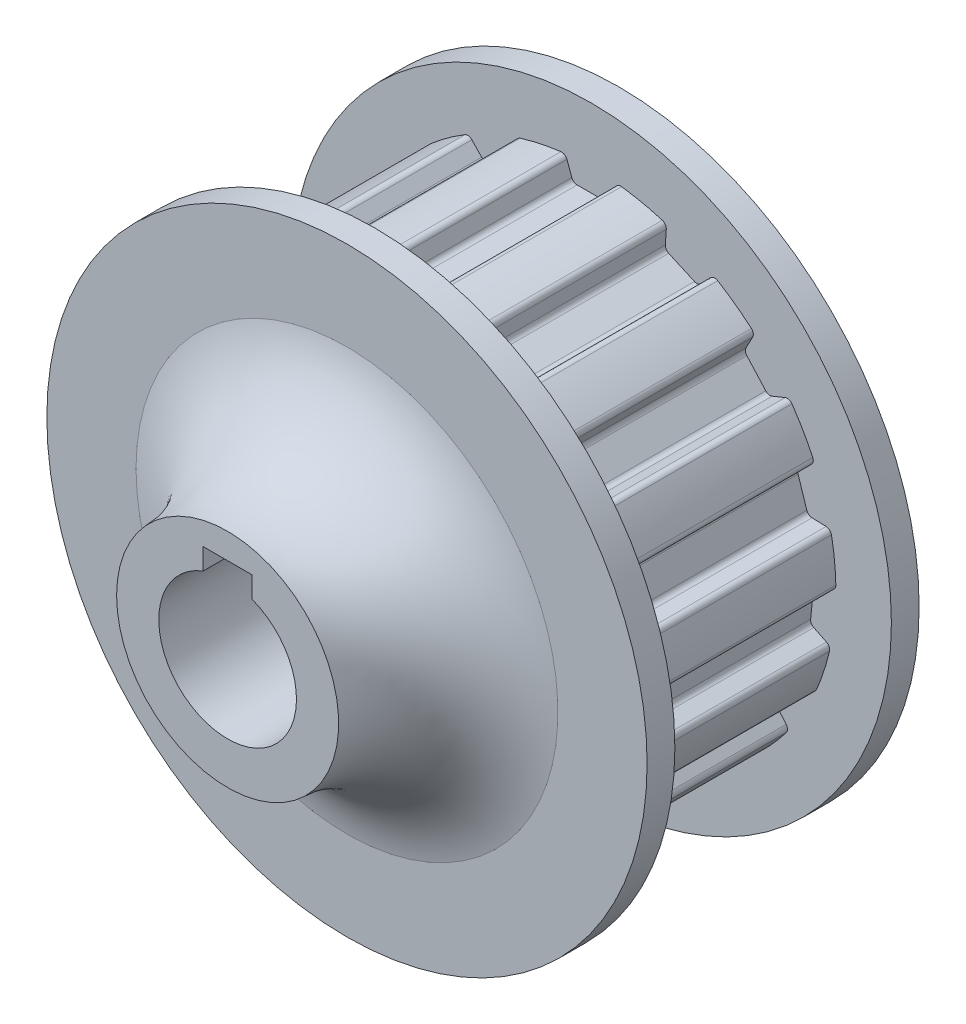
from build123d import *

# Parameters (mm, degrees)
BOSS_EXTRUDE1_DEPTH      = 7.25
BOSS_EXTRUDE1_DEPTH_BACK = 7.25
SKETCH7_R                = 22.031647778
CUT_EXTRUDE3_DEPTH       = 36.98314894
CUT_EXTRUDE3_DEPTH_BACK  = 36.98314894
SKETCH15_R               = 8.008120878
SKETCH15_R_2             = 2.25
BOSS_EXTRUDE2_DEPTH      = 5.5
SKETCH16_R               = 5
CUT_EXTRUDE4_DEPTH       = 3
BOSS_EXTRUDE3_START      = 7.5
SKETCH17_R               = 22.031647778
SKETCH17_R_2             = 5
BOSS_EXTRUDE3_DEPTH      = 7.5
CUT_EXTRUDE2_DEPTH       = 36.98314894
CUT_EXTRUDE2_DEPTH_BACK  = 36.98314894
FILLET2_R                = 0.51
BOSS_EXTRUDE4_START      = 2.5
SKETCH18_R               = 27.031647778
SKETCH18_R_2             = 22.031647778
SKETCH18_R_3             = 5
BOSS_EXTRUDE4_DEPTH      = 2.5
BOSS_EXTRUDE5_START      = -2.5
SKETCH19_R               = 27.031647778
SKETCH19_R_2             = 19
BOSS_EXTRUDE5_DEPTH      = 2.5
CUT_EXTRUDE5_DEPTH       = 52.999831377
SKETCH21_R               = 8.008120878
SKETCH21_R_2             = 6.2
SKETCH21_R_3             = 2.25
BOSS_EXTRUDE6_DEPTH      = 2.5
SKETCH21_4_R             = 8.008120878
SKETCH21_4_R_2           = 6.2
BOSS_EXTRUDE7_DEPTH      = 12


with BuildPart() as part:
    # Sketch7 → Boss-Extrude1 (new, two sides: drawn at the far end of the back side and taken through both)
    with BuildSketch(Plane.XY.offset(-BOSS_EXTRUDE1_DEPTH_BACK)):
        Circle(SKETCH7_R)
    extrude(amount=BOSS_EXTRUDE1_DEPTH + BOSS_EXTRUDE1_DEPTH_BACK)

    # Sketch14 → Revolve1 (revolve)
    with BuildSketch(Plane(origin=(0, 0, 0), x_dir=(0, 0, -1), z_dir=(1, 0, 0)), mode=Mode.PRIVATE) as revolve1_sk:
        Polygon((-18, 6.739517467), (-18, 0), (0, 0), (0, 19), (-3.355534752, 19), (-11.020158508, 12.583105693), align=None)
        with BuildLine():
            ThreePointArc((-7.25, 19), (-8.580081567, 15.465471544), (-11.020158508, 12.583105693))
            Line((-11.020158508, 12.583105693), (-3.355534752, 19))
            Line((-3.355534752, 19), (-7.25, 19))
        make_face()
        with BuildLine():
            Line((-18, 10), (-18, 6.739517467))
            Line((-18, 6.739517467), (-11.020158508, 12.583105693))
            ThreePointArc((-11.020158508, 12.583105693), (-14.286666254, 10.687865845), (-18, 10))
        make_face()
    revolve(revolve1_sk.sketch.rotate(Axis((0, 0, -36.129595921), (0, 0, 1)), 270), axis=Axis((0, 0, -36.129595921), (0, 0, 1)))

    # Sketch10 → Cut-Extrude3 (cut, two sides: drawn at the far end of the back side and taken through both)
    with BuildSketch(Plane.XY.offset(-CUT_EXTRUDE3_DEPTH_BACK)):
        with BuildLine():
            Line((2.2, 7.7), (-2.2, 7.7))
            Line((-2.2, 7.7), (-2.2, 5.796550698))
            ThreePointArc((-2.2, 5.796550698), (0, 6.2), (2.2, 5.796550698))
            Line((2.2, 5.796550698), (2.2, 7.7))
        make_face()
        with BuildLine():
            ThreePointArc((2.2, 5.796550698), (0, 6.2), (-2.2, 5.796550698))
            Line((-2.2, 5.796550698), (-2.2, 0))
            Line((-2.2, 0), (2.2, 0))
            Line((2.2, 0), (2.2, 5.796550698))
        make_face()
        with BuildLine():
            Line((-2.2, 0), (-2.2, 5.796550698))
            ThreePointArc((-2.2, 5.796550698), (-3.521363372, -5.102940329), (6.2, 0))
            ThreePointArc((6.2, 0), (5.102940329, 3.521363372), (2.2, 5.796550698))
            Line((2.2, 5.796550698), (2.2, 0))
            Line((2.2, 0), (-2.2, 0))
        make_face()
        with BuildLine():
            ThreePointArc((2.2, 5.796550698), (0, 6.2), (-2.2, 5.796550698))
            Line((-2.2, 5.796550698), (-2.2, 0))
            Line((-2.2, 0), (2.2, 0))
            Line((2.2, 0), (2.2, 5.796550698))
        make_face()
        with BuildLine():
            Line((-2.2, 0), (-2.2, 5.796550698))
            ThreePointArc((-2.2, 5.796550698), (-3.521363372, -5.102940329), (6.2, 0))
            ThreePointArc((6.2, 0), (5.102940329, 3.521363372), (2.2, 5.796550698))
            Line((2.2, 5.796550698), (2.2, 0))
            Line((2.2, 0), (-2.2, 0))
        make_face()
    extrude(amount=CUT_EXTRUDE3_DEPTH + CUT_EXTRUDE3_DEPTH_BACK, mode=Mode.SUBTRACT)

    # Sketch15 → Boss-Extrude2 (add)
    with BuildSketch(Plane(origin=(0, 0, -7.25), x_dir=(-1, 0, 0), z_dir=(0, 0, -1))):
        Circle(SKETCH15_R)
        Circle(SKETCH15_R_2, mode=Mode.SUBTRACT)
    extrude(amount=-BOSS_EXTRUDE2_DEPTH)

    # Sketch16 → Cut-Extrude4 (cut)
    with BuildSketch(Plane(origin=(0, 0, -7.25), x_dir=(-1, 0, 0), z_dir=(0, 0, -1))):
        Circle(SKETCH16_R)
    extrude(amount=-CUT_EXTRUDE4_DEPTH, mode=Mode.SUBTRACT)

    # Sketch17 → Boss-Extrude3 (add)
    with BuildSketch(Plane(origin=(0, 0, -7.25), x_dir=(-1, 0, 0), z_dir=(0, 0, -1)).offset(BOSS_EXTRUDE3_START)):
        with Locations(Location((0, 0, 0), (0, 0, 180))):
            Circle(SKETCH17_R)
        Circle(SKETCH17_R_2, mode=Mode.SUBTRACT)
    extrude(amount=-BOSS_EXTRUDE3_DEPTH)

    # Sketch8 → Cut-Extrude2 (cut, two sides: drawn at the far end of the back side and taken through both)
    with BuildSketch(Plane.XY.offset(-CUT_EXTRUDE2_DEPTH_BACK)):
        Polygon((-1.629816853, 19.998625671), (-2.369776385, 22.031647778), (2.369776385, 22.031647778), (1.629816853, 19.998625671), align=None)
        Polygon((6.645262089, 18.932559877), (6.796180007, 21.090786644), (11.125976911, 19.16303686), (9.623085654, 17.606747406), align=None)
        Polygon((13.771314846, 14.592882482), (14.787015134, 16.503136895), (17.958394952, 12.980962779), (15.952435523, 12.170502561), align=None)
        Polygon((18.516182157, 7.729963135), (20.221041008, 9.061944851), (21.68564336, 4.554362304), (19.523464367, 4.629867259), align=None)
        Polygon((20.059433359, -0.469537064), (22.15866519, 0.053860216), (21.663247022, -4.659728787), (19.718708857, -3.711314154), align=None)
        Polygon((18.134226299, -8.587850038), (20.264854855, -8.963537338), (17.89507847, -13.06811044), (16.504409446, -11.410775634), align=None)
        Polygon((13.073446767, -15.221245722), (14.867067016, -16.431057856), (11.032688279, -19.216897077), (10.436347704, -17.137210342), align=None)
        Polygon((5.752149521, -19.222749741), (6.898628226, -21.057499199), (2.262646056, -22.042907629), (2.563746633, -19.900465696), align=None)
        Polygon((-2.563746633, -19.900465696), (-2.262646056, -22.042907629), (-6.898628226, -21.057499199), (-5.752149521, -19.222749741), align=None)
        Polygon((-10.436347704, -17.137210342), (-11.032688279, -19.216897077), (-14.867067016, -16.431057856), (-13.073446767, -15.221245722), align=None)
        Polygon((-16.504409446, -11.410775634), (-17.89507847, -13.06811044), (-20.264854855, -8.963537338), (-18.134226299, -8.587850038), align=None)
        Polygon((-19.718708857, -3.711314154), (-21.663247022, -4.659728787), (-22.15866519, 0.053860216), (-20.059433359, -0.469537064), align=None)
        Polygon((-19.523464367, 4.629867259), (-21.68564336, 4.554362304), (-20.221041008, 9.061944851), (-18.516182157, 7.729963135), align=None)
        Polygon((-15.952435523, 12.170502561), (-17.958394952, 12.980962779), (-14.787015134, 16.503136895), (-13.771314846, 14.592882482), align=None)
        Polygon((-9.623085654, 17.606747406), (-11.125976911, 19.16303686), (-6.796180007, 21.090786644), (-6.645262089, 18.932559877), align=None)
    extrude(amount=CUT_EXTRUDE2_DEPTH + CUT_EXTRUDE2_DEPTH_BACK, mode=Mode.SUBTRACT)

    # Fillet2
    fillet2_edges = [part.edges().sort_by_distance(p)[0] for p in [
        (6.787047671, 20.960188161, -3.75),
        (11.035034049, 19.06886277, -3.75),
        (9.623085654, 17.606747406, -3.75),
        (6.645262089, 18.932559877, -3.75),
        (14.725553141, 16.387543699, -3.75),
        (17.837010461, 12.931920261, -3.75),
        (15.952435523, 12.170502561, -3.75),
        (13.771314846, 14.592882482, -3.75),
        (20.117876696, 8.981344056, -3.75),
        (21.55480572, 4.558931255, -3.75),
        (19.523464367, 4.629867259, -3.75),
        (18.516182157, 7.729963135, -3.75),
        (22.031636605, 0.022188433, -3.75),
        (21.545579251, -4.60233838, -3.75),
        (19.718708857, -3.711314154, -3.75),
        (20.059433359, -0.469537064, -3.75),
        (20.135926394, -8.940803772, -3.75),
        (17.810926394, -12.9678219, -3.75),
        (16.504409446, -11.410775634, -3.75),
        (18.134226299, -8.587850038, -3.75),
        (14.75853158, -16.35784978, -3.75),
        (10.996602556, -19.091051203, -3.75),
        (10.436347704, -17.137210342, -3.75),
        (13.073446767, -15.221245722, -3.75),
        (6.829252579, -20.946474955, -3.75),
        (2.280866235, -21.913264317, -3.75),
        (2.563746633, -19.900465696, -3.75),
        (5.752149521, -19.222749741, -3.75),
        (-2.280866235, -21.913264317, -3.75),
        (-6.829252579, -20.946474955, -3.75),
        (-5.752149521, -19.222749741, -3.75),
        (-2.563746633, -19.900465696, -3.75),
        (-10.996602556, -19.091051203, -3.75),
        (-14.75853158, -16.35784978, -3.75),
        (-13.073446767, -15.221245722, -3.75),
        (-10.436347704, -17.137210342, -3.75),
        (-17.810926394, -12.9678219, -3.75),
        (-20.135926394, -8.940803772, -3.75),
        (-18.134226299, -8.587850038, -3.75),
        (-16.504409446, -11.410775634, -3.75),
        (-21.545579251, -4.60233838, -3.75),
        (-22.031636605, 0.022188433, -3.75),
        (-20.059433359, -0.469537064, -3.75),
        (-19.718708857, -3.711314154, -3.75),
        (-21.55480572, 4.558931255, -3.75),
        (-20.117876696, 8.981344056, -3.75),
        (-18.516182157, 7.729963135, -3.75),
        (-19.523464367, 4.629867259, -3.75),
        (-17.837010461, 12.931920261, -3.75),
        (-14.725553141, 16.387543699, -3.75),
        (-13.771314846, 14.592882482, -3.75),
        (-15.952435523, 12.170502561, -3.75),
        (-11.035034049, 19.06886277, -3.75),
        (-6.787047671, 20.960188161, -3.75),
        (-6.645262089, 18.932559877, -3.75),
        (-9.623085654, 17.606747406, -3.75),
        (-2.325, 21.908625671, -3.75),
        (2.325, 21.908625671, -3.75),
        (1.629816853, 19.998625671, -3.75),
        (-1.629816853, 19.998625671, -3.75),
    ]]
    fillet(fillet2_edges, radius=FILLET2_R)

    # Sketch18 → Boss-Extrude4 (add)
    # profile 1 of 2: a face of its own
    with BuildSketch(Plane(origin=(0, 0, -14.75), x_dir=(-1, 0, 0), z_dir=(0, 0, -1)).offset(BOSS_EXTRUDE4_START)):
        Circle(SKETCH18_R)
        Circle(SKETCH18_R_2, mode=Mode.SUBTRACT)
    # profile 2 of 2: a face of its own
    with BuildSketch(Plane(origin=(0, 0, -14.75), x_dir=(-1, 0, 0), z_dir=(0, 0, -1)).offset(BOSS_EXTRUDE4_START)):
        Circle(SKETCH18_R_2)
        Circle(SKETCH18_R_3, mode=Mode.SUBTRACT)
    extrude(amount=-BOSS_EXTRUDE4_DEPTH)

    # Sketch19 → Boss-Extrude5 (add)
    with BuildSketch(Plane.XY.offset(7.25).offset(BOSS_EXTRUDE5_START)):
        with Locations(Location((0, 0, 0), (0, 0, 180))):
            Circle(SKETCH19_R)
        Circle(SKETCH19_R_2, mode=Mode.SUBTRACT)
    extrude(amount=BOSS_EXTRUDE5_DEPTH)

    # Sketch20 → Cut-Extrude5 (cut, through all)
    with BuildSketch(Plane.XY.offset(18)):
        with BuildLine():
            Line((-2.2, 7.7), (-2.2, 5.796550698))
            ThreePointArc((-2.2, 5.796550698), (0, 6.2), (2.2, 5.796550698))
            Line((2.2, 5.796550698), (2.2, 7.7))
            Line((2.2, 7.7), (-2.2, 7.7))
        make_face()
        with BuildLine():
            ThreePointArc((2.2, 5.796550698), (0, 6.2), (-2.2, 5.796550698))
            ThreePointArc((-2.2, 5.796550698), (-3.521363372, -5.102940329), (6.2, 0))
            ThreePointArc((6.2, 0), (5.102940329, 3.521363372), (2.2, 5.796550698))
        make_face()
    extrude(amount=-CUT_EXTRUDE5_DEPTH, mode=Mode.SUBTRACT)

    # Sketch21 → Boss-Extrude6 (add)
    # profile 1 of 2: a face of its own
    with BuildSketch(Plane.XY.offset(-5.25)):
        Circle(SKETCH21_R)
        Circle(SKETCH21_R_2, mode=Mode.SUBTRACT)
    # profile 2 of 2: a face of its own
    with BuildSketch(Plane.XY.offset(-5.25)):
        Circle(SKETCH21_R_2)
        Circle(SKETCH21_R_3, mode=Mode.SUBTRACT)
    extrude(amount=-BOSS_EXTRUDE6_DEPTH)

    # Sketch21<4> → Boss-Extrude7 (add)
    with BuildSketch(Plane.XY.offset(-5.25)):
        Circle(SKETCH21_4_R)
        Circle(SKETCH21_4_R_2, mode=Mode.SUBTRACT)
    extrude(amount=-BOSS_EXTRUDE7_DEPTH)


solid = part.part
